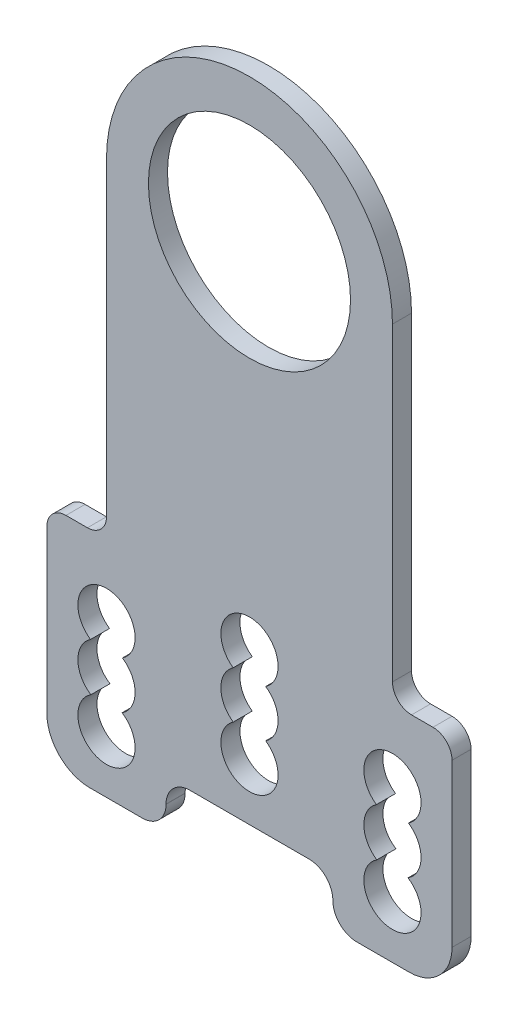
from build123d import *

# Parameters (mm, degrees)
SKETCH_1_R      = 10.6
EXTRUDE_1_DEPTH = 2


with BuildPart() as part:
    # 草图1 → 凸台-拉伸1 (new body)
    with BuildSketch(Plane.XY):
        with BuildLine():
            Line((-15, 0), (-15, -32.5))
            ThreePointArc((-15, -32.5), (-15.585786438, -33.914213562), (-17, -34.5))
            Line((-17, -34.5), (-19.25, -34.5))
            ThreePointArc((-19.25, -34.5), (-20.664213562, -35.085786438), (-21.25, -36.5))
            Line((-21.25, -36.5), (-21.25, -53.5))
            ThreePointArc((-21.25, -53.5), (-19.931980515, -56.681980515), (-16.75, -58))
            Line((-16.75, -58), (-11.25, -58))
            ThreePointArc((-11.25, -58), (-9.482233047, -57.267766953), (-8.75, -55.5))
            Line((-8.75, -55.5), (-8.75, -55.474127277))
            ThreePointArc((-8.75, -55.474127277), (-8.017766953, -53.706360324), (-6.25, -52.974127277))
            Line((-6.25, -52.974127277), (6.25, -52.974127277))
            ThreePointArc((6.25, -52.974127277), (8.017766953, -53.706360324), (8.75, -55.474127277))
            Line((8.75, -55.474127277), (8.75, -55.5))
            ThreePointArc((8.75, -55.5), (9.482233047, -57.267766953), (11.25, -58))
            Line((11.25, -58), (16.75, -58))
            ThreePointArc((16.75, -58), (19.931980515, -56.681980515), (21.25, -53.5))
            Line((21.25, -53.5), (21.25, -36.5))
            ThreePointArc((21.25, -36.5), (20.664213562, -35.085786438), (19.25, -34.5))
            Line((19.25, -34.5), (17, -34.5))
            ThreePointArc((17, -34.5), (15.585786438, -33.914213562), (15, -32.5))
            Line((15, -32.5), (15, 0))
            ThreePointArc((15, 0), (0, 15), (-15, 0))
        make_face()
        Circle(SKETCH_1_R, mode=Mode.SUBTRACT)
        with BuildLine():
            ThreePointArc((-16.638642988, -49.487063639), (-15, -55), (-13.361357012, -49.487063639))
            ThreePointArc((-13.361357012, -49.487063639), (-12.000091296, -46.997531654), (-13.322348529, -44.487063639))
            ThreePointArc((-13.322348529, -44.487063639), (-15, -39), (-16.677651471, -44.487063639))
            ThreePointArc((-16.677651471, -44.487063639), (-17.999908704, -46.997531654), (-16.638642988, -49.487063639))
        make_face(mode=Mode.SUBTRACT)
        with BuildLine():
            ThreePointArc((-1.704802234, -39.568531819), (-3, -42.037063639), (-1.704802234, -44.505595458))
            ThreePointArc((-1.704802234, -44.505595458), (0, -49.974127277), (1.704802234, -44.505595458))
            ThreePointArc((1.704802234, -44.505595458), (3, -42.037063639), (1.704802234, -39.568531819))
            ThreePointArc((1.704802234, -39.568531819), (0, -34.1), (-1.704802234, -39.568531819))
        make_face(mode=Mode.SUBTRACT)
        with BuildLine():
            ThreePointArc((13.361357012, -49.487063639), (15, -55), (16.638642988, -49.487063639))
            ThreePointArc((16.638642988, -49.487063639), (17.999908704, -46.997531654), (16.677651471, -44.487063639))
            ThreePointArc((16.677651471, -44.487063639), (15, -39), (13.322348529, -44.487063639))
            ThreePointArc((13.322348529, -44.487063639), (12.000091296, -46.997531654), (13.361357012, -49.487063639))
        make_face(mode=Mode.SUBTRACT)
    extrude(amount=EXTRUDE_1_DEPTH)


solid = part.part
